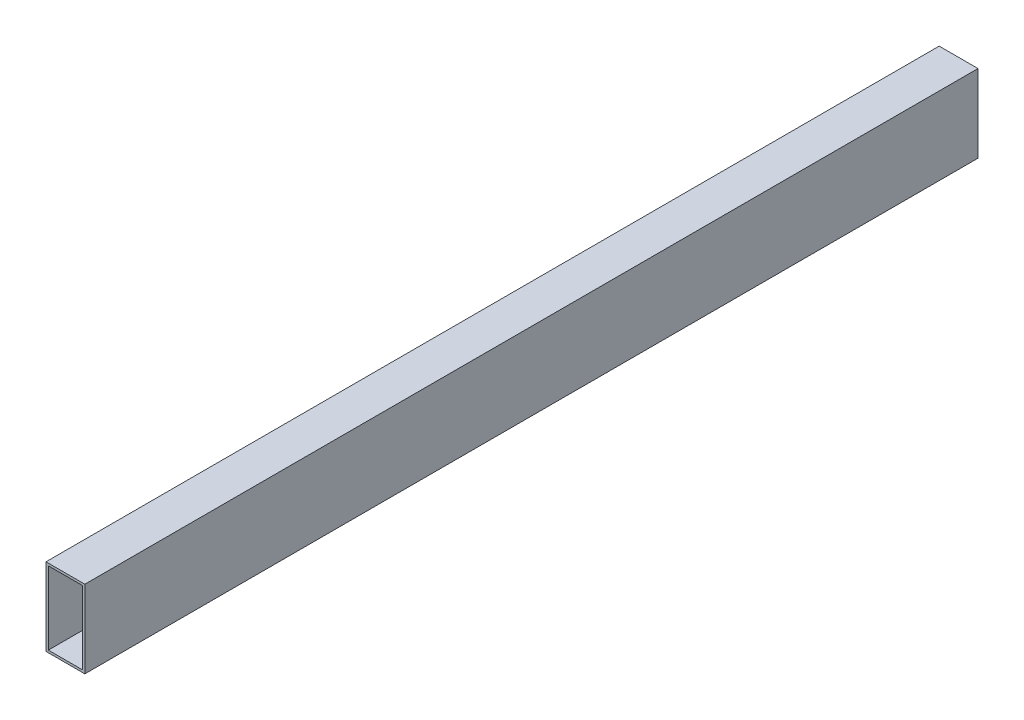
from build123d import *

# Parameters (mm, degrees)
SKETCH2_W           = 25.4
SKETCH2_H           = 50.8
SKETCH2_W_2         = 22.352
SKETCH2_H_2         = 47.752
EXTRUDE_THIN1_DEPTH = 584.2


with BuildPart() as part:
    # Sketch2 → Extrude-Thin1 (new body)
    with BuildSketch(Plane.XY):
        with Locations((-12.7, 25.4)):
            Rectangle(SKETCH2_W, SKETCH2_H)
        with Locations((-12.7, 25.4)):
            Rectangle(SKETCH2_W_2, SKETCH2_H_2, mode=Mode.SUBTRACT)
    extrude(amount=EXTRUDE_THIN1_DEPTH)


solid = part.part
